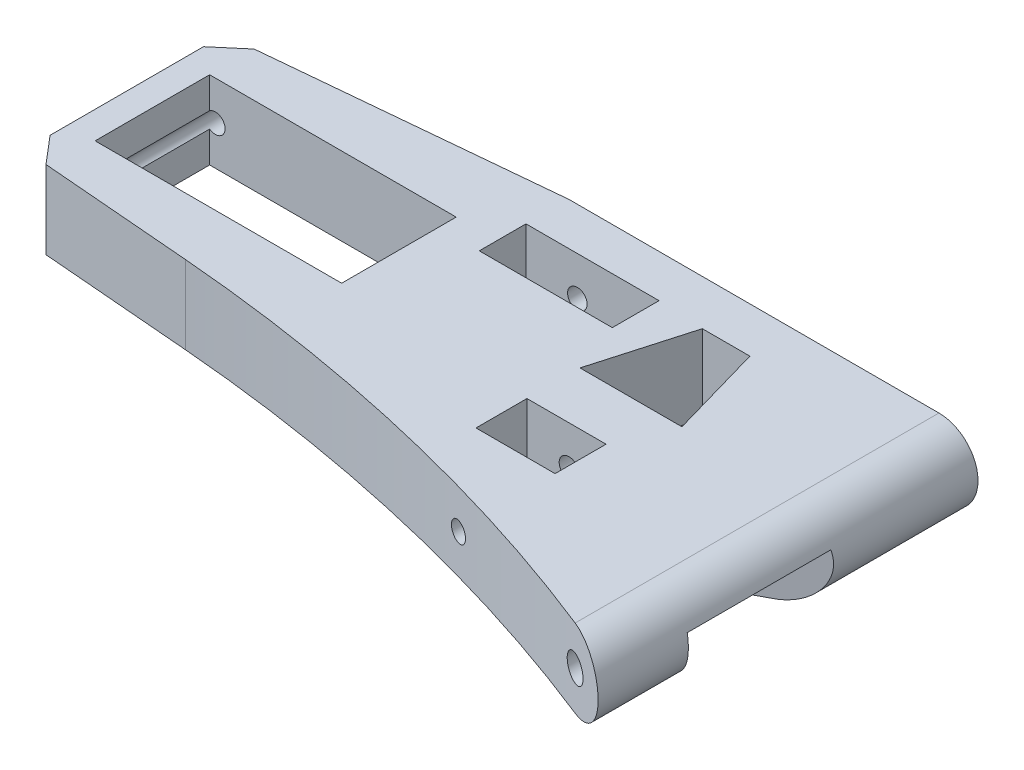
from build123d import *

# Parameters (mm, degrees)
SKETCH1_W                = 36.8554
SKETCH1_H                = 17.1196
SKETCH1_W_2              = 19.8882
SKETCH1_H_2              = 6.985
SKETCH1_W_3              = 11.8237
SKETCH1_H_3              = 7.62
BOSS_EXTRUDE1_DEPTH      = 11.684
CUT_EXTRUDE7_DEPTH       = 139.474144195
CUT_EXTRUDE7_DEPTH_BACK  = 139.474144195
SKETCH3_R                = 1.4605
CUT_EXTRUDE8_DEPTH       = 139.474144228
SKETCH4_R                = 1.4605
CUT_EXTRUDE9_DEPTH       = 18.034
SKETCH5_R                = 1.4605
CUT_EXTRUDE10_DEPTH      = 16.3195
CUT_EXTRUDE11_DEPTH      = 139.474144228
CUT_EXTRUDE11_DEPTH_BACK = 139.474144228
SKETCH6_R                = 1.9685
CUT_EXTRUDE12_DEPTH      = 7.62


with BuildPart() as part:
    # Sketch1 → Boss-Extrude1 (new body)
    with BuildSketch(Plane(origin=(0, 0, 0), x_dir=(1, 0, 0), z_dir=(0, 1, 0))):
        with BuildLine():
            Line((-25.4, 34.376681198), (-67.6656, 34.376681198))
            Line((-67.6656, 34.376681198), (-86.5378, 34.376681198))
            Line((-86.5378, 34.376681198), (-129.54, 30.312681198))
            Line((-129.54, 30.312681198), (-133.6294, 26.832881198))
            Line((-133.6294, 26.832881198), (-133.6294, 3.896681198))
            Line((-133.6294, 3.896681198), (-130.1496, -0.192718802))
            Line((-130.1496, -0.192718802), (-107.423789895, -2.069465817))
            ThreePointArc((-107.423789895, -2.069465817), (-65.592867309, -8.938068561), (-25.4, -22.411642903))
            Line((-25.4, -22.411642903), (-25.4, 34.376681198))
        make_face()
        with Locations((-111.1123, 15.098081198)):
            Rectangle(SKETCH1_W, SKETCH1_H, mode=Mode.SUBTRACT)
        with Locations((-76.64751862, 24.508781198)):
            Rectangle(SKETCH1_W_2, SKETCH1_H_2, mode=Mode.SUBTRACT)
        with Locations((-57.99455, 1.650285214)):
            Rectangle(SKETCH1_W_3, SKETCH1_H_3, mode=Mode.SUBTRACT)
        Polygon((-63.9064, 13.384739375), (-48.6664, 13.384739375), (-52.7304, 27.608739375), (-59.8424, 27.608739375), align=None, mode=Mode.SUBTRACT)
    extrude(amount=BOSS_EXTRUDE1_DEPTH)

    # Sketch2 → Cut-Extrude7 (cut, two sides: drawn at the far end of the back side and taken through both)
    with BuildSketch(Plane.XY.offset(-CUT_EXTRUDE7_DEPTH_BACK)):
        with BuildLine():
            Line((-25.4, 11.684), (-31.242, 11.684))
            ThreePointArc((-31.242, 11.684), (-27.111082184, 9.972917816), (-25.4, 5.842))
            Line((-25.4, 5.842), (-25.4, 11.684))
        make_face()
        with BuildLine():
            Line((-25.4, 0), (-25.4, 5.842))
            ThreePointArc((-25.4, 5.842), (-27.111082184, 1.711082184), (-31.242, 0))
            Line((-31.242, 0), (-25.4, 0))
        make_face()
    extrude(amount=CUT_EXTRUDE7_DEPTH + CUT_EXTRUDE7_DEPTH_BACK, mode=Mode.SUBTRACT)

    # Sketch3 → Cut-Extrude8 (cut, through all)
    with BuildSketch(Plane.XY):
        with Locations((-128.6891, 5.842)):
            Circle(SKETCH3_R)
    extrude(amount=-CUT_EXTRUDE8_DEPTH, mode=Mode.SUBTRACT)

    # Sketch4 → Cut-Extrude9 (cut)
    with BuildSketch(Plane(origin=(0, 0, -34.376681198), x_dir=(-1, 0, 0), z_dir=(0, 0, -1))):
        with Locations((78.9178, 5.842)):
            Circle(SKETCH4_R)
    extrude(amount=-CUT_EXTRUDE9_DEPTH, mode=Mode.SUBTRACT)

    # Sketch5 → Cut-Extrude10 (cut, symmetric)
    with BuildSketch(Plane.XY):
        with Locations((-57.6326, 5.842)):
            Circle(SKETCH5_R)
    extrude(amount=CUT_EXTRUDE10_DEPTH, both=True, mode=Mode.SUBTRACT)

    # Sketch6 → Cut-Extrude11 (cut, two sides: drawn at the far end of the back side and taken through both)
    with BuildSketch(Plane.XY.offset(-CUT_EXTRUDE11_DEPTH_BACK)):
        with Locations((-31.242, 5.842)):
            Circle(SKETCH6_R)
    extrude(amount=CUT_EXTRUDE11_DEPTH + CUT_EXTRUDE11_DEPTH_BACK, mode=Mode.SUBTRACT)

    # Sketch8 → Cut-Extrude12 (cut)
    with BuildSketch(Plane.XZ):
        with BuildLine():
            Line((-34.127459258, 5.550738999), (-23.258487089, 9.749460917))
            Line((-23.258487089, 9.749460917), (-23.258487089, -12.81023225))
            Line((-23.258487089, -12.81023225), (-23.258487089, -13.936212277))
            Line((-23.258487089, -13.936212277), (-34.934853819, -7.703267827))
            ThreePointArc((-34.934853819, -7.703267827), (-38.784988232, -0.817133676), (-34.127459258, 5.550738999))
        make_face()
    extrude(amount=-CUT_EXTRUDE12_DEPTH, mode=Mode.SUBTRACT)


solid = part.part
